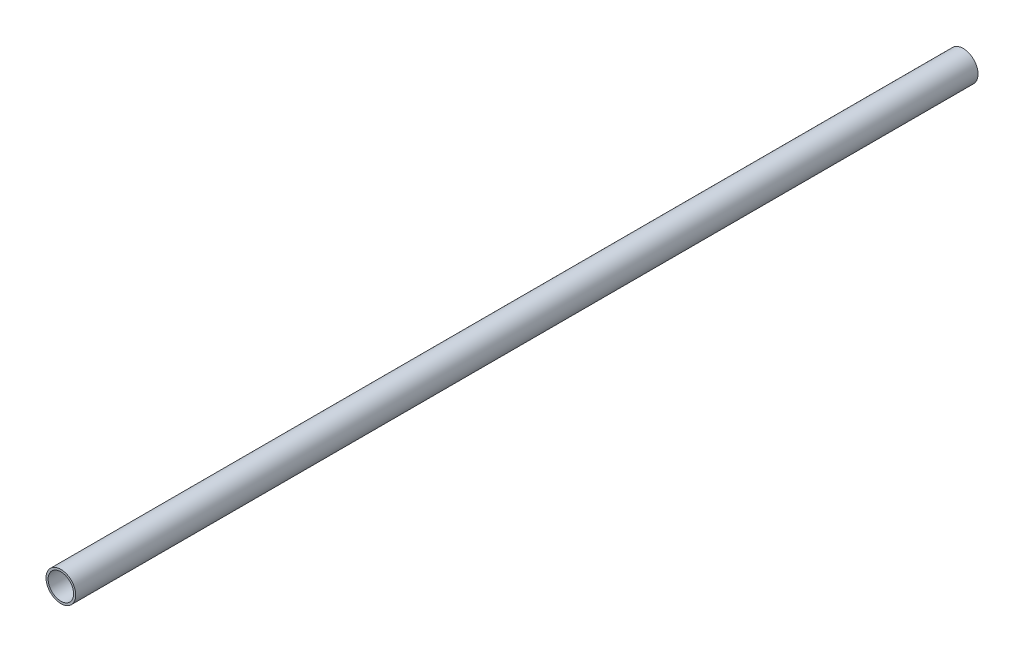
from build123d import *

# Parameters (mm, degrees)
SKETCH1_R           = 7
SKETCH1_R_2         = 6
BOSS_EXTRUDE1_DEPTH = 424.86


with BuildPart() as part:
    # Sketch1 → Boss-Extrude1 (new body)
    with BuildSketch(Plane.XY):
        with Locations(Location((0, 0, 0), (0, 0, 180))):
            Circle(SKETCH1_R)
        with Locations(Location((0, 0, 0), (0, 0, 180))):
            Circle(SKETCH1_R_2, mode=Mode.SUBTRACT)
    extrude(amount=BOSS_EXTRUDE1_DEPTH)


solid = part.part
